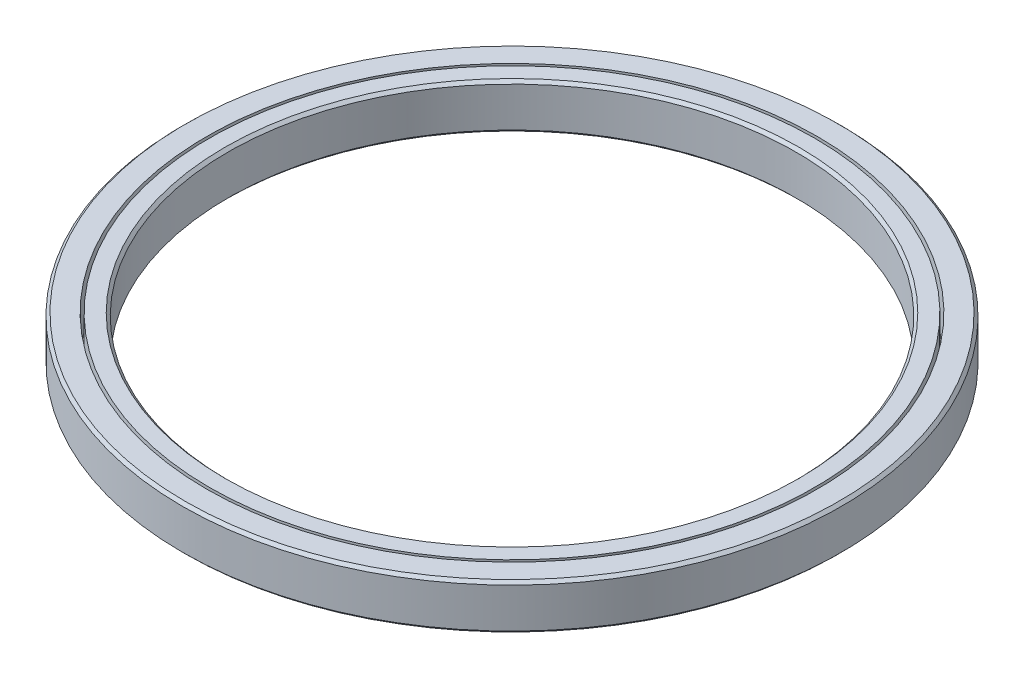
from build123d import *

# Parameters (mm, degrees)
SKETCH_1_R      = 58
SKETCH_1_R_2    = 53.75
EXTRUDE_1_DEPTH = 8
SKETCH_2_R      = 53.25
SKETCH_2_R_2    = 50
EXTRUDE_2_DEPTH = 8
CHAMFER_1_SIZE  = 0.5
CHAMFER_2_SIZE  = 0.5


with BuildPart() as part:
    # 草图1 → 凸台-拉伸1 (new body)
    with BuildSketch(Plane(origin=(0, 0, 0), x_dir=(1, 0, 0), z_dir=(0, 1, 0))):
        with Locations(Location((0, 0, 0), (0, 0, 270))):
            Circle(SKETCH_1_R)
        with Locations(Location((0, 0, 0), (0, 0, 270))):
            Circle(SKETCH_1_R_2, mode=Mode.SUBTRACT)
    extrude(amount=EXTRUDE_1_DEPTH)

    # 倒角1
    chamfer_1_edges = [part.edges().sort_by_distance(p)[0] for p in [
        (0, 0, -58),
        (0, 8, -58),
    ]]
    chamfer(chamfer_1_edges, length=CHAMFER_1_SIZE)


with BuildPart() as body_2:
    # 草图2 → 凸台-拉伸2 (new body)
    with BuildSketch(Plane(origin=(0, 0, 0), x_dir=(1, 0, 0), z_dir=(0, 1, 0))):
        with Locations(Location((0, 0, 0), (0, 0, 270))):
            Circle(SKETCH_2_R)
        with Locations(Location((0, 0, 0), (0, 0, 270))):
            Circle(SKETCH_2_R_2, mode=Mode.SUBTRACT)
    extrude(amount=EXTRUDE_2_DEPTH)

    # 倒角2
    chamfer_2_edges = [body_2.edges().sort_by_distance(p)[0] for p in [
        (0, 0, -50),
        (0, 8, -50),
    ]]
    chamfer(chamfer_2_edges, length=CHAMFER_2_SIZE)


solid = Compound([part.part, body_2.part])
